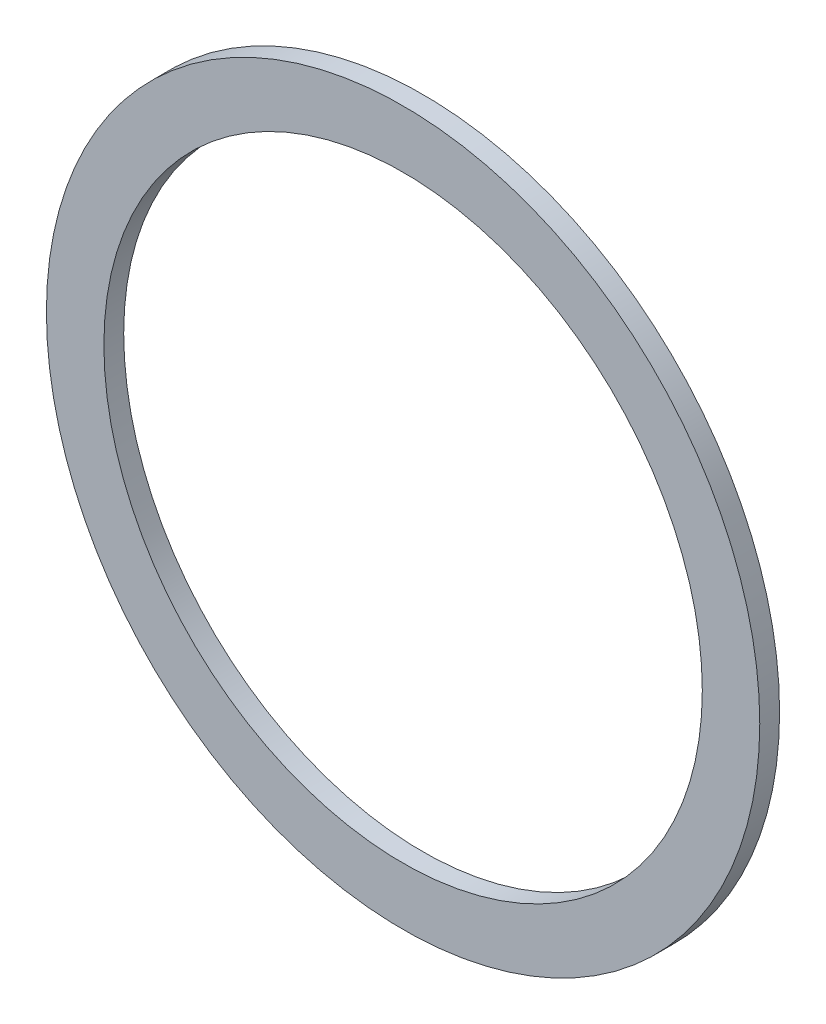
from build123d import *

# Parameters (mm, degrees)
SKETCH1_R           = 18
SKETCH1_R_2         = 15.1
BOSS_EXTRUDE1_DEPTH = 1


with BuildPart() as part:
    # Sketch1 → Boss-Extrude1 (new body)
    with BuildSketch(Plane(origin=(0, 0, 0), x_dir=(0, 1, 0), z_dir=(0, 0, 1))):
        with Locations(Location((0, 0, 0), (0, 0, 270))):
            Circle(SKETCH1_R)
        with Locations(Location((0, 0, 0), (0, 0, 270))):
            Circle(SKETCH1_R_2, mode=Mode.SUBTRACT)
    extrude(amount=BOSS_EXTRUDE1_DEPTH)


solid = part.part
